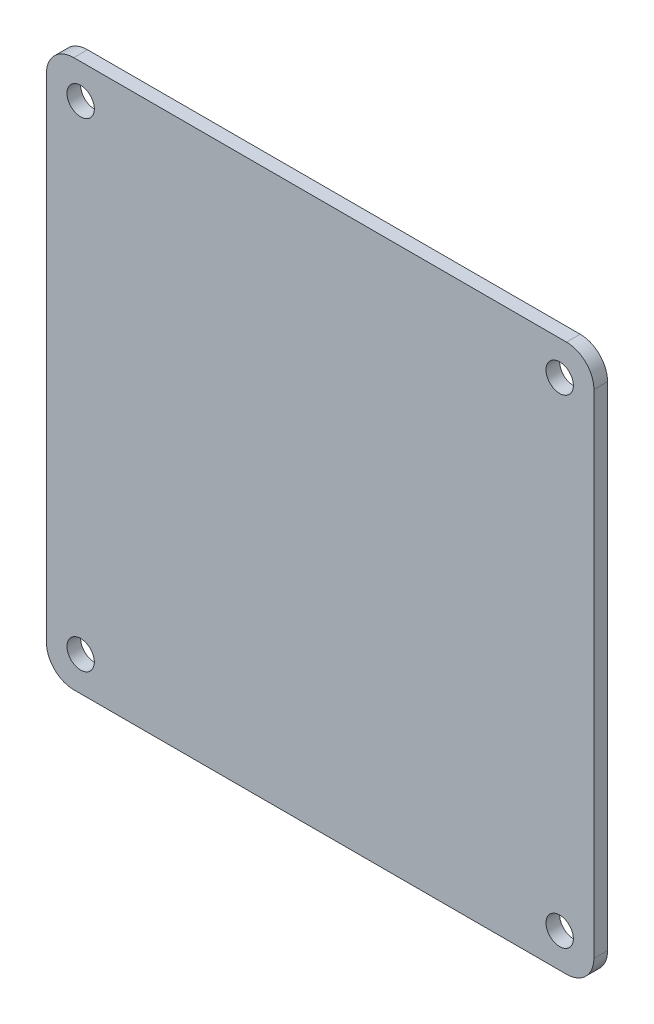
from build123d import *

# Parameters (mm, degrees)
BOSS_EXTRUDE1_DEPTH = 2.54
SKETCH4_R           = 2.54
CUT_EXTRUDE2_DEPTH  = 2.54


with BuildPart() as part:
    # Sketch1 → Boss-Extrude1 (new body)
    with BuildSketch(Plane.XY):
        with BuildLine():
            Line((-96.52, 0), (-5.08, 0))
            ThreePointArc((-5.08, 0), (-1.487897552, 1.487897552), (0, 5.08))
            Line((0, 5.08), (0, 96.52))
            ThreePointArc((0, 96.52), (-1.487897552, 100.112102448), (-5.08, 101.6))
            Line((-5.08, 101.6), (-96.52, 101.6))
            ThreePointArc((-96.52, 101.6), (-100.112102448, 100.112102448), (-101.6, 96.52))
            Line((-101.6, 96.52), (-101.6, 5.08))
            ThreePointArc((-101.6, 5.08), (-100.112102448, 1.487897552), (-96.52, 0))
        make_face()
    extrude(amount=BOSS_EXTRUDE1_DEPTH)

    # Sketch4 → Cut-Extrude2 (cut)
    with BuildSketch(Plane.XY):
        with Locations((-95.25, 6.35)):
            Circle(SKETCH4_R)
        with Locations(Location((-6.35, 6.35, 0), (0, 0, 180))):
            Circle(SKETCH4_R)
        with Locations((-6.35, 95.25)):
            Circle(SKETCH4_R)
        with Locations(Location((-95.25, 95.25, 0), (0, 0, 180))):
            Circle(SKETCH4_R)
    extrude(amount=CUT_EXTRUDE2_DEPTH, mode=Mode.SUBTRACT)


solid = part.part
